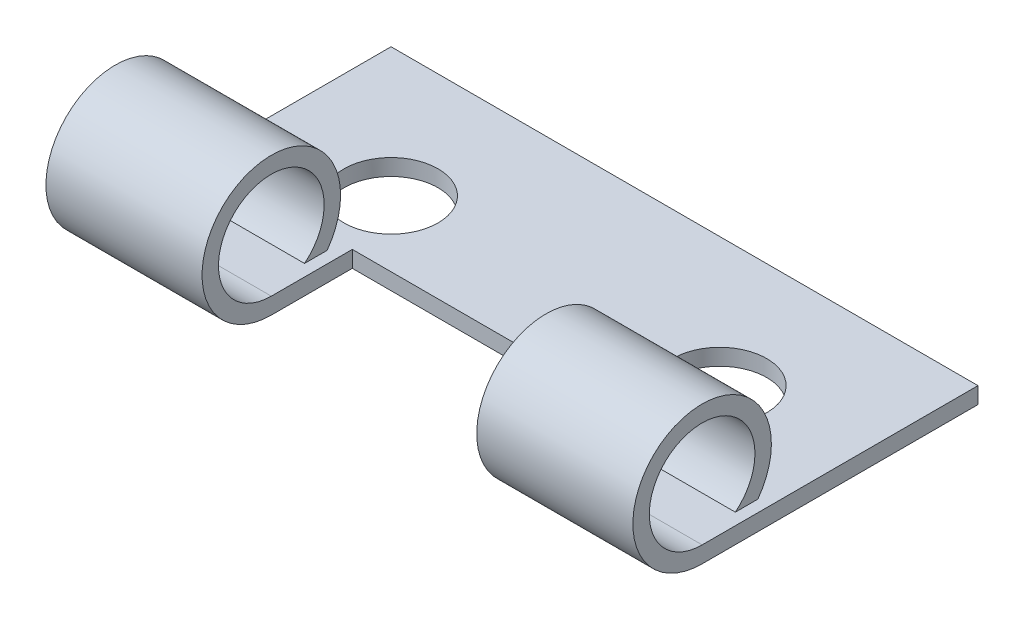
from build123d import *

# Parameters (mm, degrees)
SALIENTE_EXTRUIR1_DEPTH    = 12.5
CORTAR_EXTRUIR1_REACH      = 21.475
CROQUIS5_R                 = 2
CORTAR_EXTRUIR2_DEPTH      = 20.475369059
CORTAR_EXTRUIR2_DEPTH_BACK = 20.475369059
CROQUIS6_W                 = 11.7
CROQUIS6_H                 = 6.4


with BuildPart() as part:
    # Croquis4 → Saliente-Extruir1 (new, symmetric)
    with BuildSketch(Plane(origin=(0, 0, 0), x_dir=(0, 0, -1), z_dir=(1, 0, 0))):
        with BuildLine():
            Line((14, 0), (14, 0.7))
            Line((14, 0.7), (2.25, 0.7))
            ThreePointArc((2.25, 0.7), (1.5, 5.071320344), (3.664213562, 1.2))
            Line((3.664213562, 1.2), (4.624868417, 1.2))
            ThreePointArc((4.624868417, 1.2), (0.91958653, 5.582964109), (2.25, 0))
            Line((2.25, 0), (14, 0))
        make_face()
    extrude(amount=SALIENTE_EXTRUIR1_DEPTH, both=True)

    # Croquis5 → Cortar-Extruir1 (cut, up to next)
    with BuildSketch(Plane(origin=(0, 0.7, 0), x_dir=(1, 0, 0), z_dir=(0, 1, 0)), mode=Mode.PRIVATE) as cortar_extruir1_sk1:
        with Locations(Location((7, 8.5, 0), (0, 0, 270))):
            Circle(CROQUIS5_R)
    cortar_extruir1_tool1 = extrude(cortar_extruir1_sk1.sketch, amount=-CORTAR_EXTRUIR1_REACH, mode=Mode.PRIVATE) & part.part
    # Croquis5 → Cortar-Extruir1 (cut, up to next)
    with BuildSketch(Plane(origin=(0, 0.7, 0), x_dir=(1, 0, 0), z_dir=(0, 1, 0)), mode=Mode.PRIVATE) as cortar_extruir1_sk2:
        with Locations(Location((-7, 8.5, 0), (0, 0, 270))):
            Circle(CROQUIS5_R)
    cortar_extruir1_tool2 = extrude(cortar_extruir1_sk2.sketch, amount=-CORTAR_EXTRUIR1_REACH, mode=Mode.PRIVATE) & part.part
    add(cortar_extruir1_tool1.solids().sort_by_distance((7, 0.7, -8.5))[0], mode=Mode.SUBTRACT)
    add(cortar_extruir1_tool2.solids().sort_by_distance((-7, 0.7, -8.5))[0], mode=Mode.SUBTRACT)

    # Croquis6 → Cortar-Extruir2 (cut, two sides: drawn at the far end of the back side and taken through both)
    with BuildSketch(Plane(origin=(0, 0.7, 0), x_dir=(1, 0, 0), z_dir=(0, 1, 0)).offset(-CORTAR_EXTRUIR2_DEPTH_BACK)):
        with Locations((0, 2.5)):
            Rectangle(CROQUIS6_W, CROQUIS6_H)
    extrude(amount=CORTAR_EXTRUIR2_DEPTH + CORTAR_EXTRUIR2_DEPTH_BACK, mode=Mode.SUBTRACT)


solid = part.part
